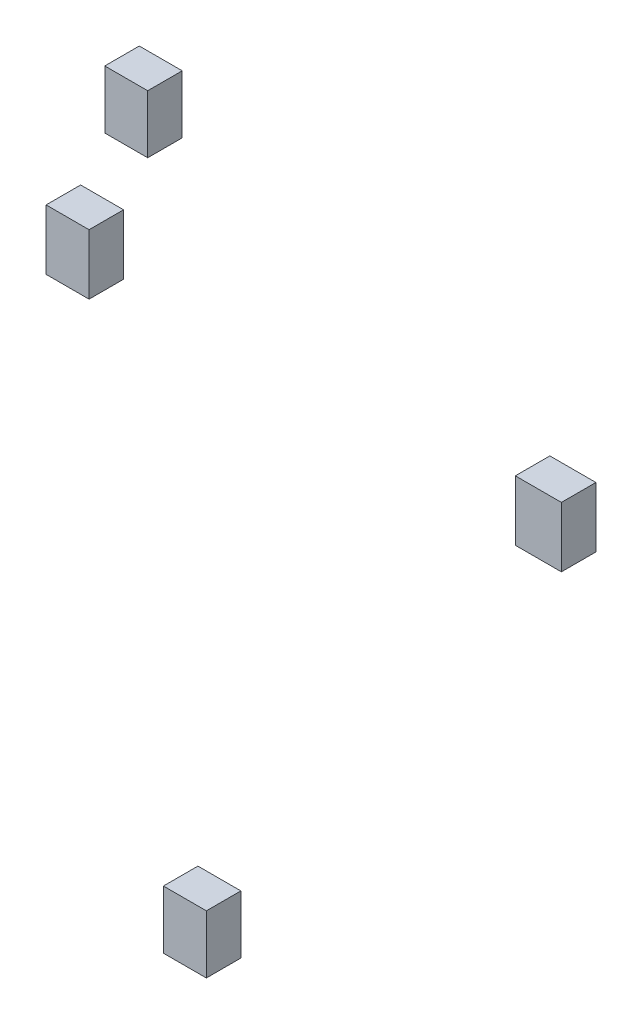
from build123d import *

# Parameters (mm, degrees)
SKETCH1_W                 = 9.02
SKETCH1_H                 = 12.201430126
BOSS_EXTRUDE1_DEPTH       = 7.25
SKETCH1_H_2               = 12.64
BOSS_EXTRUDE1_2_DEPTH     = 7.25
SKETCH1_W_2               = 9.67230149
BOSS_EXTRUDE1_3_DEPTH     = 7.25
SKETCH1_H_3               = 12.221430126
BOSS_EXTRUDE1_4_DEPTH     = 7.25
SHELL1_T                  = -0.5
SHELL1_THICKNESS_2_FACE_W = 8.02
SHELL1_THICKNESS_2_FACE_H = 11.201430126
SHELL1_THICKNESS_2_DEPTH  = 0.3
SHELL2_T                  = -0.5
SHELL2_THICKNESS_2_FACE_W = 8.02
SHELL2_THICKNESS_2_FACE_H = 11.64
SHELL2_THICKNESS_2_DEPTH  = 0.3
SHELL3_T                  = -0.5
SHELL3_THICKNESS_2_FACE_W = 8.67230149
SHELL3_THICKNESS_2_FACE_H = 11.64
SHELL3_THICKNESS_2_DEPTH  = 0.3
SHELL4_T                  = -0.5
SHELL4_THICKNESS_2_FACE_W = 8.02
SHELL4_THICKNESS_2_FACE_H = 11.221430126
SHELL4_THICKNESS_2_DEPTH  = 0.3


with BuildPart() as part:
    # Sketch1 → Boss-Extrude1 (new body)
    with BuildSketch(Plane.XY):
        with Locations((-12.3155, 71.520715063)):
            Rectangle(SKETCH1_W, SKETCH1_H)
    extrude(amount=BOSS_EXTRUDE1_DEPTH)

    # Shell1
    shell1_openings = [part.faces().sort_by_distance(p)[0] for p in [
        (-12.3155, 71.520715063, 0),
    ]]
    offset(amount=SHELL1_T, openings=shell1_openings, kind=Kind.INTERSECTION)

    # Shell1 thickness 2 face (on inner face of the shell) → Shell1 thickness 2 (cut)
    with BuildSketch(Plane(origin=(-12.3155, 71.520715063, 6.75), x_dir=(1, 0, 0), z_dir=(0, 0, 1))):
        Rectangle(SHELL1_THICKNESS_2_FACE_W, SHELL1_THICKNESS_2_FACE_H)
    extrude(amount=SHELL1_THICKNESS_2_DEPTH, mode=Mode.SUBTRACT)


with BuildPart() as body_2:
    # Sketch1 → Boss-Extrude1 2 (new body)
    with BuildSketch(Plane.XY):
        with Locations((-24.6355, 39.86)):
            Rectangle(SKETCH1_W, SKETCH1_H_2)
    extrude(amount=BOSS_EXTRUDE1_2_DEPTH)

    # Shell2
    shell2_openings = [body_2.faces().sort_by_distance(p)[0] for p in [
        (-24.6355, 39.86, 0),
    ]]
    offset(amount=SHELL2_T, openings=shell2_openings, kind=Kind.INTERSECTION)

    # Shell2 thickness 2 face (on inner face of the shell) → Shell2 thickness 2 (cut)
    with BuildSketch(Plane(origin=(-24.6355, 39.86, 6.75), x_dir=(1, 0, 0), z_dir=(0, 0, 1))):
        Rectangle(SHELL2_THICKNESS_2_FACE_W, SHELL2_THICKNESS_2_FACE_H)
    extrude(amount=SHELL2_THICKNESS_2_DEPTH, mode=Mode.SUBTRACT)


with BuildPart() as body_3:
    # Sketch1 → Boss-Extrude1 3 (new body)
    with BuildSketch(Plane.XY):
        with Locations((74.250650745, 39.86)):
            Rectangle(SKETCH1_W_2, SKETCH1_H_2)
    extrude(amount=BOSS_EXTRUDE1_3_DEPTH)

    # Shell3
    shell3_openings = [body_3.faces().sort_by_distance(p)[0] for p in [
        (74.250650745, 39.86, 0),
    ]]
    offset(amount=SHELL3_T, openings=shell3_openings, kind=Kind.INTERSECTION)

    # Shell3 thickness 2 face (on inner face of the shell) → Shell3 thickness 2 (cut)
    with BuildSketch(Plane(origin=(74.250650745, 39.86, 6.75), x_dir=(1, 0, 0), z_dir=(0, 0, 1))):
        Rectangle(SHELL3_THICKNESS_2_FACE_W, SHELL3_THICKNESS_2_FACE_H)
    extrude(amount=SHELL3_THICKNESS_2_DEPTH, mode=Mode.SUBTRACT)


with BuildPart() as body_4:
    # Sketch1 → Boss-Extrude1 4 (new body)
    with BuildSketch(Plane.XY):
        with Locations((0.0045, -71.510715063)):
            Rectangle(SKETCH1_W, SKETCH1_H_3)
    extrude(amount=BOSS_EXTRUDE1_4_DEPTH)

    # Shell4
    shell4_openings = [body_4.faces().sort_by_distance(p)[0] for p in [
        (0.0045, -71.510715063, 0),
    ]]
    offset(amount=SHELL4_T, openings=shell4_openings, kind=Kind.INTERSECTION)

    # Shell4 thickness 2 face (on inner face of the shell) → Shell4 thickness 2 (cut)
    with BuildSketch(Plane(origin=(0.0045, -71.510715063, 6.75), x_dir=(1, 0, 0), z_dir=(0, 0, 1))):
        Rectangle(SHELL4_THICKNESS_2_FACE_W, SHELL4_THICKNESS_2_FACE_H)
    extrude(amount=SHELL4_THICKNESS_2_DEPTH, mode=Mode.SUBTRACT)


solid = Compound([part.part, body_2.part, body_3.part, body_4.part])
